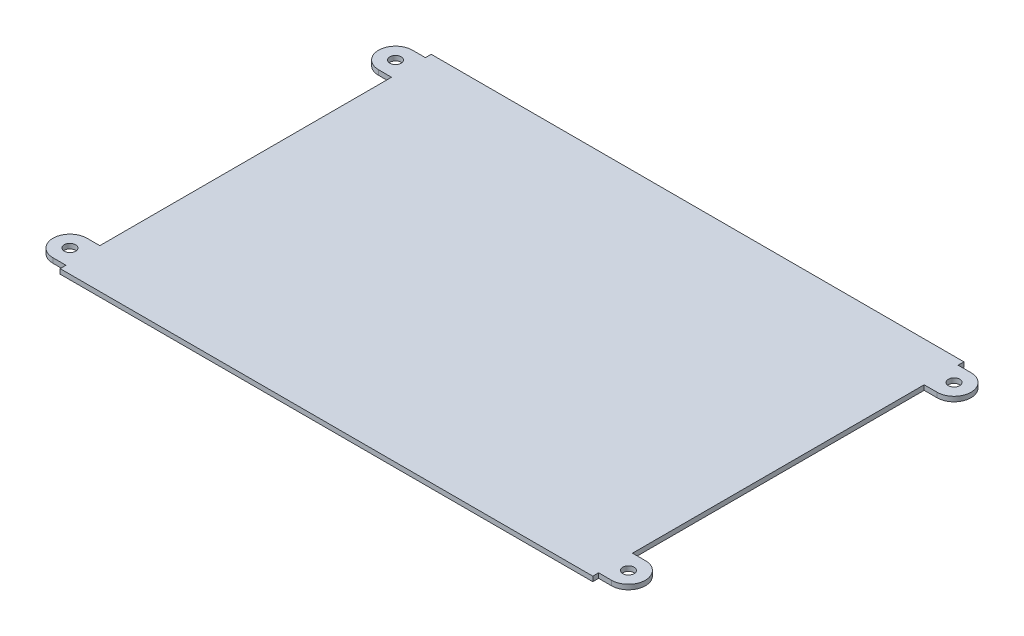
from build123d import *

# Parameters (mm, degrees)
SKETCH1_W               = 164.9
SKETCH1_H               = 114.9
BOSS_EXTRUDE1_DEPTH     = 1.5
SKETCH2_R               = 1.75
BOSS_EXTRUDE2_DEPTH     = 1.5
LPATTERN1_COUNT         = 2
LPATTERN1_PITCH         = 100.8
MIRROR1_COPY_1_SKETCH_R = 1.75
MIRROR1_COPY_1_DEPTH    = 1.5


with BuildPart() as part:
    # Sketch1 → Boss-Extrude1 (new body)
    with BuildSketch(Plane(origin=(0, 0, 0), x_dir=(1, 0, 0), z_dir=(0, 1, 0))):
        Rectangle(SKETCH1_W, SKETCH1_H)
    extrude(amount=BOSS_EXTRUDE1_DEPTH)

    # Sketch2 → Boss-Extrude2 (add)
    with BuildSketch(Plane(origin=(0, 1.5, 0), x_dir=(1, 0, 0), z_dir=(0, 1, 0))):
        with BuildLine():
            Line((-82.45, 55.65), (-82.45, 45.15))
            Line((-82.45, 45.15), (-86.45, 45.15))
            ThreePointArc((-86.45, 45.15), (-91.7, 50.4), (-86.45, 55.65))
            Line((-86.45, 55.65), (-82.45, 55.65))
        make_face()
        with Locations(Location((-86.45, 50.4, 0), (0, 0, 270))):
            Circle(SKETCH2_R, mode=Mode.SUBTRACT)
    boss_extrude2 = extrude(amount=-BOSS_EXTRUDE2_DEPTH)

    # LPattern1: Boss-Extrude2 ×2
    with Locations(*[(0, 0, i * LPATTERN1_PITCH) for i in range(1, LPATTERN1_COUNT)]):
        add(boss_extrude2)

    # Mirror1: Boss-Extrude2 across plane
    add(boss_extrude2.mirror(Plane(origin=(0, 0, 0), x_dir=(0, 0, 1), z_dir=(1, 0, 0))))

    # Mirror1 copy 1 sketch → Mirror1 copy 1 (add)
    with BuildSketch(Plane(origin=(0, 1.5, 100.8), x_dir=(-1, 0, 0), z_dir=(0, 1, 0))):
        with BuildLine():
            Line((-82.45, -55.65), (-82.45, -45.15))
            Line((-82.45, -45.15), (-86.45, -45.15))
            ThreePointArc((-86.45, -45.15), (-91.7, -50.4), (-86.45, -55.65))
            Line((-86.45, -55.65), (-82.45, -55.65))
        make_face()
        with Locations((-86.45, -50.4)):
            Circle(MIRROR1_COPY_1_SKETCH_R, mode=Mode.SUBTRACT)
    extrude(amount=-MIRROR1_COPY_1_DEPTH)


solid = part.part
